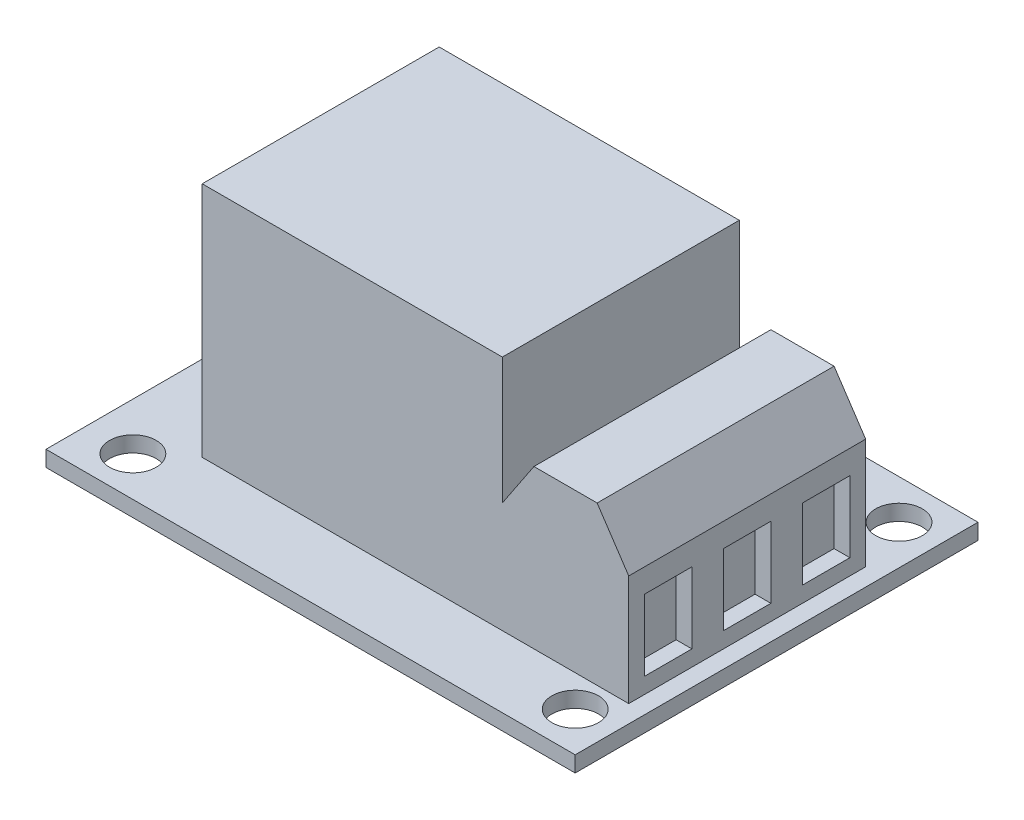
from build123d import *

# Parameters (mm, degrees)
ESQUISSE1_W             = 33.5
ESQUISSE1_H             = 25.5
ESQUISSE1_R             = 1.475
BOSS_EXTRU_9_DEPTH      = 1
ESQUISSE1_17_W          = 8
ESQUISSE1_17_H          = 15
BOSS_EXTRU_12_DEPTH     = 10
CHANFREIN5_SIZE         = 2
CHANFREIN5_SIZE2        = 3
ESQUISSE6_W             = 3
ESQUISSE6_H             = 4.5
ENL_V_MAT_EXTRU_1_DEPTH = 1
ESQUISSE1_18_W          = 19
ESQUISSE1_18_H          = 15
BOSS_EXTRU_14_DEPTH     = 15


with BuildPart() as part:
    # Esquisse1 → Boss.-Extru.9 (new body)
    with BuildSketch(Plane(origin=(0, 0, 0), x_dir=(1, 0, 0), z_dir=(0, 1, 0))):
        with Locations((-5.3869574, 4.310655738)):
            Rectangle(ESQUISSE1_W, ESQUISSE1_H)
        with Locations((-19.1369574, -5.939344262)):
            Circle(ESQUISSE1_R, mode=Mode.SUBTRACT)
        with Locations((8.8630426, -5.939344262)):
            Circle(ESQUISSE1_R, mode=Mode.SUBTRACT)
        with Locations((-19.1369574, 14.560655738)):
            Circle(ESQUISSE1_R, mode=Mode.SUBTRACT)
        with Locations((8.8630426, 14.560655738)):
            Circle(ESQUISSE1_R, mode=Mode.SUBTRACT)
    extrude(amount=-BOSS_EXTRU_9_DEPTH)

    # Esquisse1<17> → Boss.-Extru.12 (add)
    with BuildSketch(Plane(origin=(0, 0, 0), x_dir=(1, 0, 0), z_dir=(0, 1, 0))):
        with Locations((6.252459016, 3.560655738)):
            Rectangle(ESQUISSE1_17_W, ESQUISSE1_17_H)
    extrude(amount=BOSS_EXTRU_12_DEPTH)

    # Chanfrein5
    chanfrein5_edges = [part.edges().sort_by_distance(p)[0] for p in [
        (2.252459016, 10, -3.560655738),
        (10.252459016, 10, -3.560655738),
    ]]
    chanfrein5_side = [part.faces().sort_by_distance(p)[0] for p in [
        (6.252459016, 10, -3.560655738),
    ]]
    chamfer(chanfrein5_edges, length=CHANFREIN5_SIZE, length2=CHANFREIN5_SIZE2, reference=chanfrein5_side[0])

    # Esquisse6 → Enlèv. mat.-Extru.1 (cut)
    with BuildSketch(Plane(origin=(10.252459016, 0, 0), x_dir=(0, 0, -1), z_dir=(1, 0, 0))):
        with Locations((3.560655738, 3.25)):
            Rectangle(ESQUISSE6_W, ESQUISSE6_H)
        with Locations((8.560655738, 3.25)):
            Rectangle(ESQUISSE6_W, ESQUISSE6_H)
        with Locations((-1.439344262, 3.25)):
            Rectangle(ESQUISSE6_W, ESQUISSE6_H)
    extrude(amount=-ENL_V_MAT_EXTRU_1_DEPTH, mode=Mode.SUBTRACT)

    # Esquisse1<18> → Boss.-Extru.14 (add)
    with BuildSketch(Plane(origin=(0, 0, 0), x_dir=(1, 0, 0), z_dir=(0, 1, 0))):
        with Locations((-7.247540984, 3.560655738)):
            Rectangle(ESQUISSE1_18_W, ESQUISSE1_18_H)
    extrude(amount=BOSS_EXTRU_14_DEPTH)


solid = part.part
